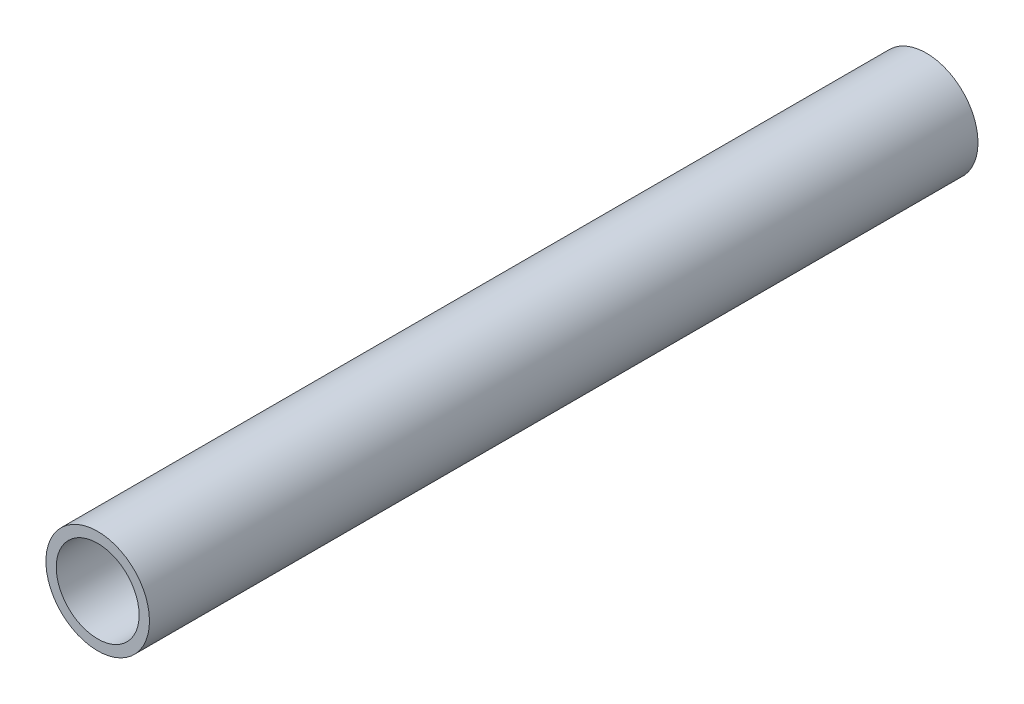
from build123d import *

# Parameters (mm, degrees)
ESQUISSE1_R        = 10
ESQUISSE1_R_2      = 8
BOSS_EXTRU_1_DEPTH = 160


with BuildPart() as part:
    # Esquisse1 → Boss.-Extru.1 (new body)
    with BuildSketch(Plane.XY):
        Circle(ESQUISSE1_R)
        Circle(ESQUISSE1_R_2, mode=Mode.SUBTRACT)
    extrude(amount=BOSS_EXTRU_1_DEPTH)


solid = part.part
